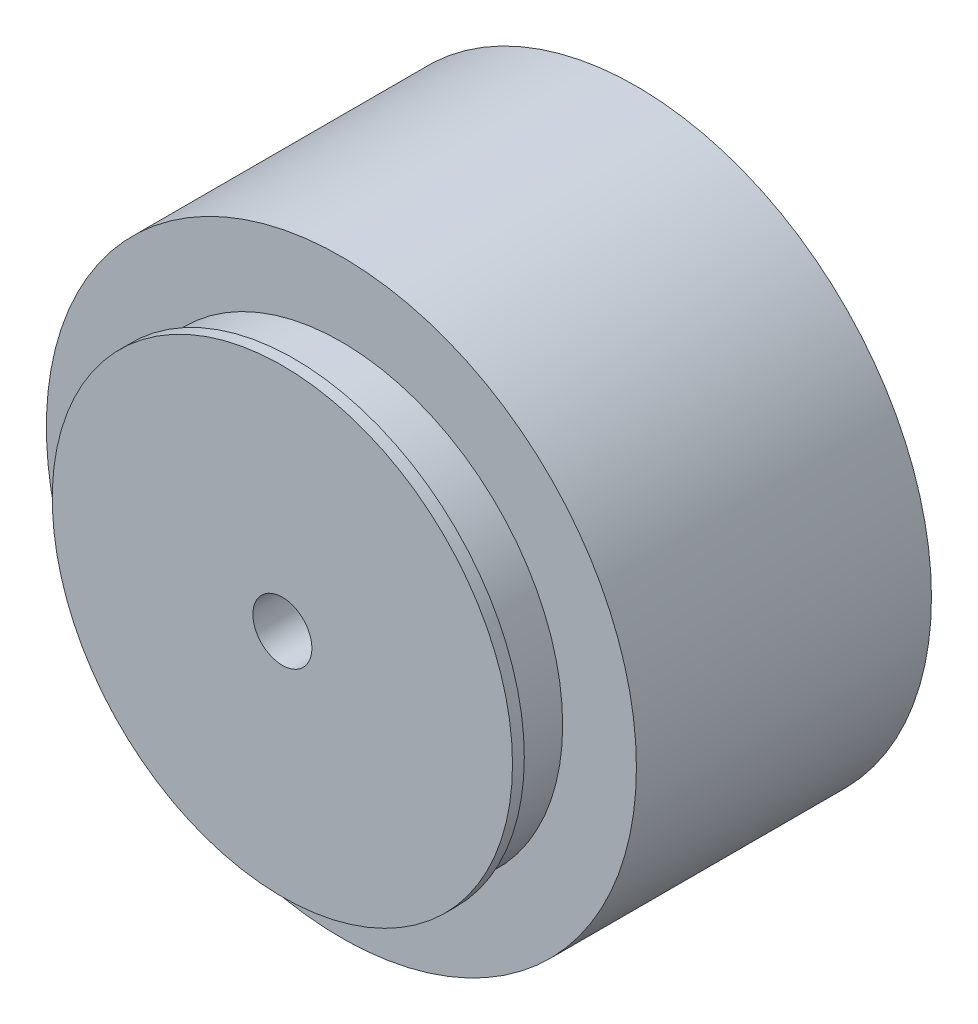
from build123d import *

# Parameters (mm, degrees)
SKETCH1_R           = 50
SKETCH1_R_2         = 5
BOSS_EXTRUDE1_DEPTH = 50
SKETCH2_R           = 37.5
SKETCH2_R_2         = 5
BOSS_EXTRUDE2_DEPTH = 8
SKETCH3_R           = 39
SKETCH3_R_2         = 5
BOSS_EXTRUDE3_DEPTH = 2
BOSS_EXTRUDE4_START = 10
SKETCH4_R           = 15
SKETCH4_R_2         = 5
BOSS_EXTRUDE4_DEPTH = 10


with BuildPart() as part:
    # Sketch1 → Boss-Extrude1 (new body)
    with BuildSketch(Plane.XY):
        Circle(SKETCH1_R)
        Circle(SKETCH1_R_2, mode=Mode.SUBTRACT)
    extrude(amount=BOSS_EXTRUDE1_DEPTH)

    # Sketch2 → Boss-Extrude2 (add)
    with BuildSketch(Plane.XY.offset(50)):
        Circle(SKETCH2_R)
        Circle(SKETCH2_R_2, mode=Mode.SUBTRACT)
    extrude(amount=BOSS_EXTRUDE2_DEPTH)

    # Sketch3 → Boss-Extrude3 (add)
    with BuildSketch(Plane.XY.offset(58)):
        Circle(SKETCH3_R)
        Circle(SKETCH3_R_2, mode=Mode.SUBTRACT)
    extrude(amount=BOSS_EXTRUDE3_DEPTH)

    # Sketch4 → Boss-Extrude4 (add)
    with BuildSketch(Plane(origin=(0, 0, 0), x_dir=(-1, 0, 0), z_dir=(0, 0, -1)).offset(BOSS_EXTRUDE4_START)):
        with Locations(Location((0, 0, 0), (0, 0, 180))):
            Circle(SKETCH4_R)
        Circle(SKETCH4_R_2, mode=Mode.SUBTRACT)
    extrude(amount=-BOSS_EXTRUDE4_DEPTH)


solid = part.part
